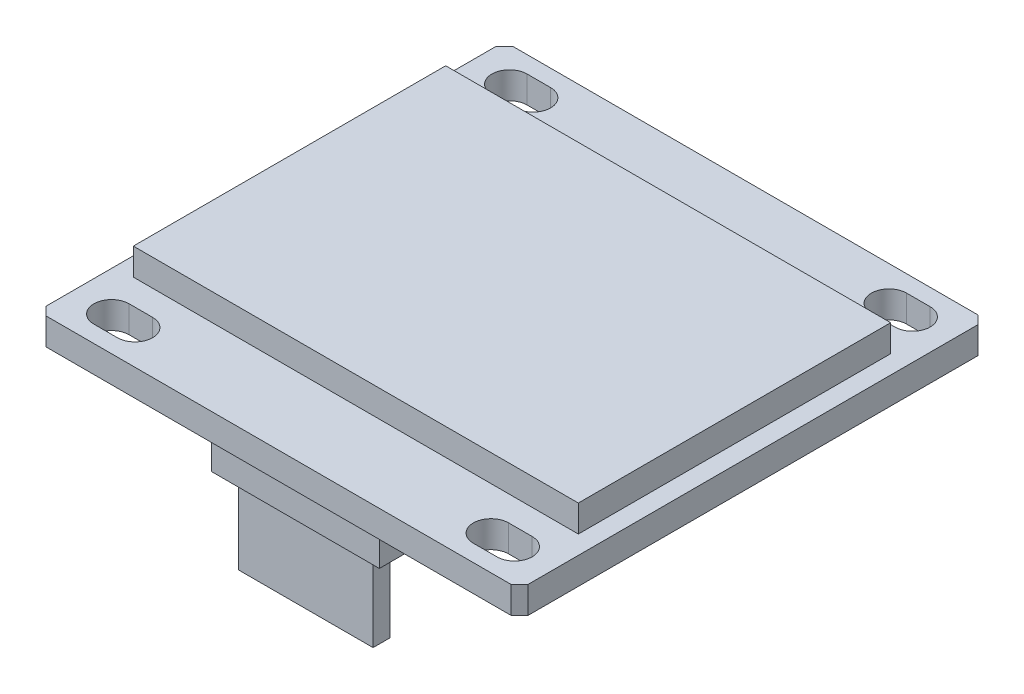
from build123d import *

# Parameters (mm, degrees)
SKETCH_1_W          = 28.7
SKETCH_1_H          = 27.8
EXTRUDE_1_DEPTH     = 1.6
SKETCH_2_W          = 26.5
SKETCH_2_H          = 18.6
EXTRUDE_2_DEPTH     = 1.6
CUT_EXTRUDE_1_DEPTH = 21.042267836
CHAMFER_1_SIZE      = 0.5
SKETCH_4_W          = 10
SKETCH_4_H          = 2.5
EXTRUDE_3_DEPTH     = 2.5
SKETCH_5_W          = 8
SKETCH_5_H          = 1
EXTRUDE_4_DEPTH     = 5


with BuildPart() as part:
    # 草图1 → 凸台-拉伸1 (new body)
    with BuildSketch(Plane(origin=(0, 0, 0), x_dir=(1, 0, 0), z_dir=(0, 1, 0))):
        Rectangle(SKETCH_1_W, SKETCH_1_H)
    extrude(amount=EXTRUDE_1_DEPTH)

    # 草图2 → 凸台-拉伸2 (add)
    with BuildSketch(Plane(origin=(0, 1.6, 0), x_dir=(1, 0, 0), z_dir=(0, 1, 0))):
        Rectangle(SKETCH_2_W, SKETCH_2_H)
    extrude(amount=EXTRUDE_2_DEPTH)

    # 草图3 → 切除-拉伸1 (cut, through all)
    with BuildSketch(Plane(origin=(0, 1.6, 0), x_dir=(1, 0, 0), z_dir=(0, 1, 0))):
        with BuildLine():
            Line((-12, 12.9), (-10.6, 12.9))
            ThreePointArc((-10.6, 12.9), (-9.55, 11.85), (-10.6, 10.8))
            Line((-10.6, 10.8), (-12, 10.8))
            ThreePointArc((-12, 10.8), (-13.05, 11.85), (-12, 12.9))
        make_face()
        with BuildLine():
            Line((12, 12.9), (10.6, 12.9))
            ThreePointArc((10.6, 12.9), (9.55, 11.85), (10.6, 10.8))
            Line((10.6, 10.8), (12, 10.8))
            ThreePointArc((12, 10.8), (13.05, 11.85), (12, 12.9))
        make_face()
        with BuildLine():
            Line((12, -12.9), (10.6, -12.9))
            ThreePointArc((10.6, -12.9), (9.55, -11.85), (10.6, -10.8))
            Line((10.6, -10.8), (12, -10.8))
            ThreePointArc((12, -10.8), (13.05, -11.85), (12, -12.9))
        make_face()
        with BuildLine():
            Line((-12, -12.9), (-10.6, -12.9))
            ThreePointArc((-10.6, -12.9), (-9.55, -11.85), (-10.6, -10.8))
            Line((-10.6, -10.8), (-12, -10.8))
            ThreePointArc((-12, -10.8), (-13.05, -11.85), (-12, -12.9))
        make_face()
    extrude(amount=-CUT_EXTRUDE_1_DEPTH, mode=Mode.SUBTRACT)

    # 倒角1
    chamfer_1_edges = [part.edges().sort_by_distance(p)[0] for p in [
        (14.35, 0.8, 13.9),
        (-14.35, 0.8, 13.9),
        (-14.35, 0.8, -13.9),
        (14.35, 0.8, -13.9),
    ]]
    chamfer(chamfer_1_edges, length=CHAMFER_1_SIZE)

    # 草图4 → 凸台-拉伸3 (add)
    with BuildSketch(Plane.XZ):
        with Locations((0, 11.65)):
            Rectangle(SKETCH_4_W, SKETCH_4_H)
    extrude(amount=EXTRUDE_3_DEPTH)

    # 草图5 → 凸台-拉伸4 (add)
    with BuildSketch(Plane.XZ.offset(2.5)):
        with Locations((-0.103219582, 11.669441564)):
            Rectangle(SKETCH_5_W, SKETCH_5_H)
    extrude(amount=EXTRUDE_4_DEPTH)


solid = part.part
